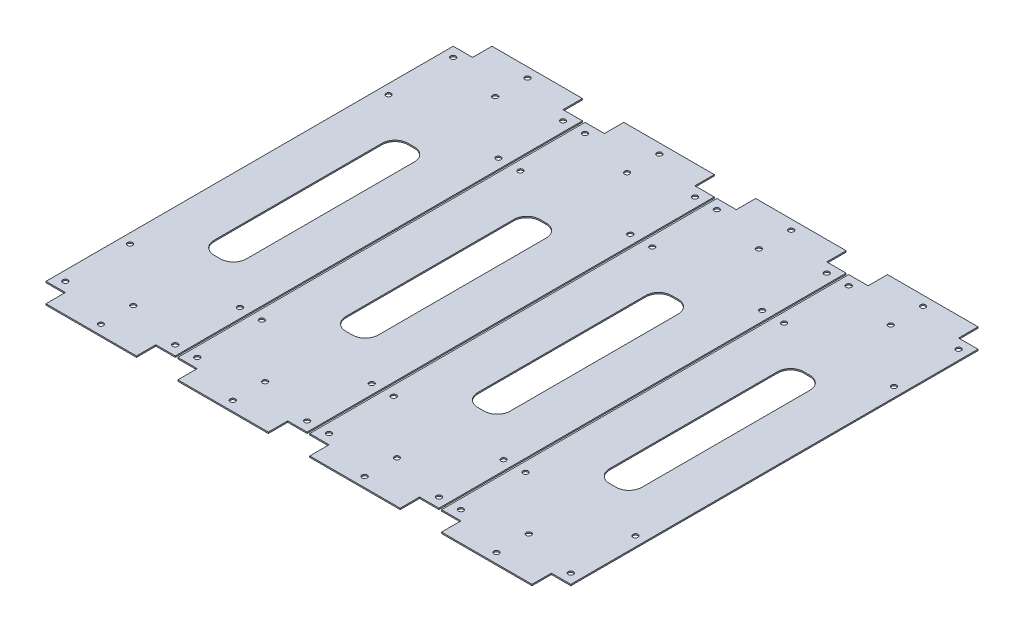
from build123d import *

# Parameters (mm, degrees)
SKETCH1_R           = 2
SKETCH1_W           = 25
SKETCH1_H           = 150
BOSS_EXTRUDE1_DEPTH = 1
FILLET1_R           = 10
LPATTERN1_COUNT     = 4
LPATTERN1_PITCH     = 102


with BuildPart() as part:
    # Sketch1 → Boss-Extrude1 (new body)
    with BuildSketch(Plane(origin=(0, 0, 0), x_dir=(1, 0, 0), z_dir=(0, 1, 0))):
        Polygon((-35, 157.5), (-35, 172.5), (35, 172.5), (35, 157.5), (50, 157.5), (50, -157.5), (35, -157.5), (35, -172.5), (-35, -172.5), (-35, -157.5), (-50, -157.5), (-50, 157.5), align=None)
        with Locations(Location((0, 140, 0), (0, 0, 270))):
            Circle(SKETCH1_R, mode=Mode.SUBTRACT)
        with Locations(Location((0, -140, 0), (0, 0, 270))):
            Circle(SKETCH1_R, mode=Mode.SUBTRACT)
        with Locations(Location((42.5, 150, 0), (0, 0, 270))):
            Circle(SKETCH1_R, mode=Mode.SUBTRACT)
        with Locations(Location((42.5, -150, 0), (0, 0, 270))):
            Circle(SKETCH1_R, mode=Mode.SUBTRACT)
        with Locations(Location((42.5, -100, 0), (0, 0, 270))):
            Circle(SKETCH1_R, mode=Mode.SUBTRACT)
        with Locations(Location((42.5, 100, 0), (0, 0, 270))):
            Circle(SKETCH1_R, mode=Mode.SUBTRACT)
        with Locations(Location((-42.5, 150, 0), (0, 0, 270))):
            Circle(SKETCH1_R, mode=Mode.SUBTRACT)
        with Locations(Location((-42.5, 100, 0), (0, 0, 270))):
            Circle(SKETCH1_R, mode=Mode.SUBTRACT)
        with Locations(Location((-42.5, -100, 0), (0, 0, 270))):
            Circle(SKETCH1_R, mode=Mode.SUBTRACT)
        with Locations(Location((-42.5, -150, 0), (0, 0, 270))):
            Circle(SKETCH1_R, mode=Mode.SUBTRACT)
        with Locations(Location((0, 165, 0), (0, 0, 270))):
            Circle(SKETCH1_R, mode=Mode.SUBTRACT)
        with Locations(Location((0, -165, 0), (0, 0, 270))):
            Circle(SKETCH1_R, mode=Mode.SUBTRACT)
        Rectangle(SKETCH1_W, SKETCH1_H, mode=Mode.SUBTRACT)
    extrude(amount=BOSS_EXTRUDE1_DEPTH)

    # Fillet1
    fillet1_edges = [part.edges().sort_by_distance(p)[0] for p in [
        (12.5, 0.5, 75),
        (12.5, 0.5, -75),
        (-12.5, 0.5, -75),
        (-12.5, 0.5, 75),
    ]]
    fillet(fillet1_edges, radius=FILLET1_R)


with BuildPart() as lpattern1_1:
    # LPattern1: pattern copy
    add(part.part.moved(Location(Vector(1, 0, 0) * (1 * LPATTERN1_PITCH))))


with BuildPart() as lpattern1_2:
    # LPattern1: pattern copy
    add(part.part.moved(Location(Vector(1, 0, 0) * (2 * LPATTERN1_PITCH))))


with BuildPart() as lpattern1_3:
    # LPattern1: pattern copy
    add(part.part.moved(Location(Vector(1, 0, 0) * (3 * LPATTERN1_PITCH))))


solid = Compound([part.part, lpattern1_1.part, lpattern1_2.part, lpattern1_3.part])
